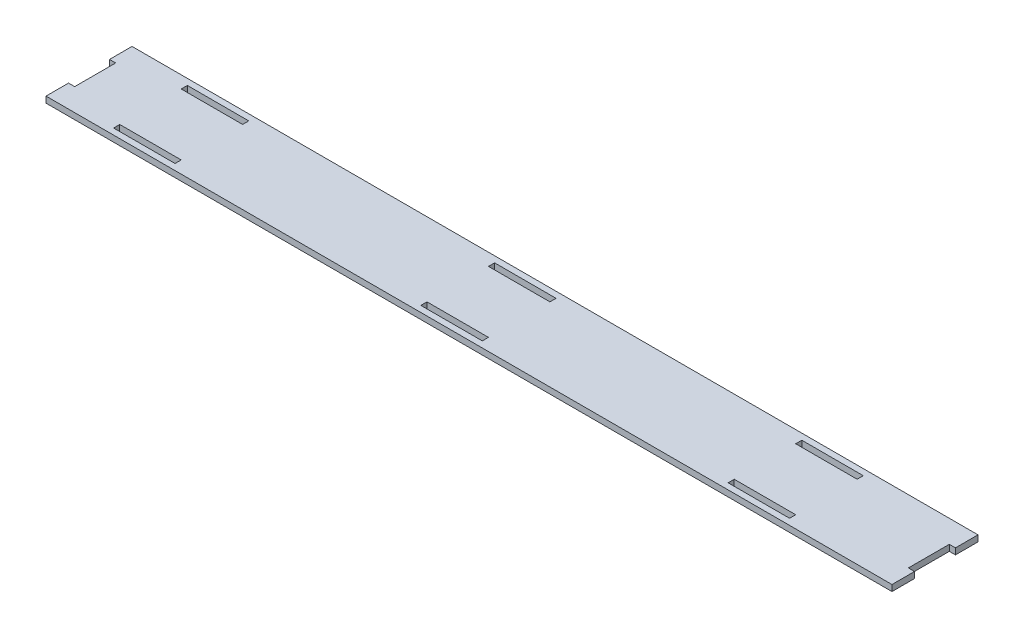
from build123d import *

# Parameters (mm, degrees)
SKETCH1_W           = 30
SKETCH1_H           = 3
BOSS_EXTRUDE1_DEPTH = 3


with BuildPart() as part:
    # Sketch1 → Boss-Extrude1 (new body)
    with BuildSketch(Plane(origin=(0, 0, 0), x_dir=(1, 0, 0), z_dir=(0, 1, 0))):
        Polygon((0, 0), (413, 0), (413, 11), (410, 11), (410, 31), (413, 31), (413, 42), (0, 42), (0, 31), (3, 31), (3, 11), (0, 11), align=None)
        with Locations((45, 37.5)):
            Rectangle(SKETCH1_W, SKETCH1_H, mode=Mode.SUBTRACT)
        with Locations((195, 37.5)):
            Rectangle(SKETCH1_W, SKETCH1_H, mode=Mode.SUBTRACT)
        with Locations((345, 37.5)):
            Rectangle(SKETCH1_W, SKETCH1_H, mode=Mode.SUBTRACT)
        with Locations((345, 4.5)):
            Rectangle(SKETCH1_W, SKETCH1_H, mode=Mode.SUBTRACT)
        with Locations((195, 4.5)):
            Rectangle(SKETCH1_W, SKETCH1_H, mode=Mode.SUBTRACT)
        with Locations((45, 4.5)):
            Rectangle(SKETCH1_W, SKETCH1_H, mode=Mode.SUBTRACT)
    extrude(amount=BOSS_EXTRUDE1_DEPTH)


solid = part.part
